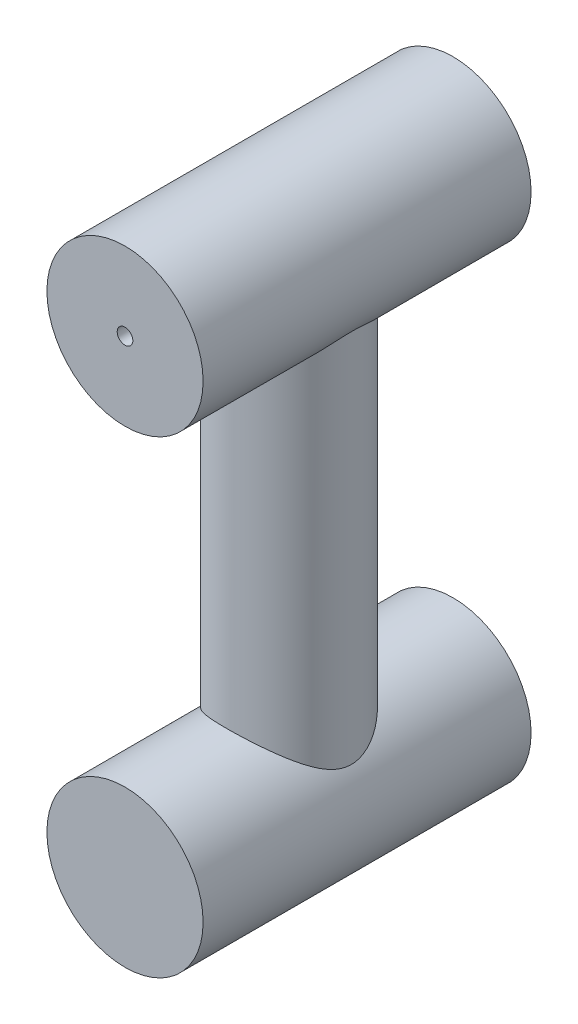
from build123d import *

# Parameters (mm, degrees)
SKETCH1_R           = 25
BOSS_EXTRUDE1_DEPTH = 52.5
SKETCH2_R           = 2.5
CUT_EXTRUDE1_DEPTH  = 10
SKETCH3_R           = 20
BOSS_EXTRUDE2_DEPTH = 150
CUT_EXTRUDE2_START  = -5
SKETCH4_R           = 2.5
CUT_EXTRUDE2_DEPTH  = 5


with BuildPart() as part:
    # Sketch1 → Boss-Extrude1 (new, symmetric)
    with BuildSketch(Plane.XY):
        Circle(SKETCH1_R)
    boss_extrude1 = extrude(amount=BOSS_EXTRUDE1_DEPTH, both=True)

    # Sketch2 → Cut-Extrude1 (cut)
    with BuildSketch(Plane(origin=(0, 0, -52.5), x_dir=(-1, 0, 0), z_dir=(0, 0, -1))):
        Circle(SKETCH2_R)
    cut_extrude1 = extrude(amount=-CUT_EXTRUDE1_DEPTH, mode=Mode.SUBTRACT)

    # Sketch3 → Boss-Extrude2 (add)
    with BuildSketch(Plane(origin=(0, 0, 0), x_dir=(1, 0, 0), z_dir=(0, 1, 0))):
        with Locations(Location((0, 0, 0), (0, 0, 90))):
            Circle(SKETCH3_R)
    extrude(amount=BOSS_EXTRUDE2_DEPTH)

    # Mirror1: Boss-Extrude1, Cut-Extrude1 across plane
    add(boss_extrude1.mirror(Plane.ZX.offset(75)))
    add(cut_extrude1.mirror(Plane.ZX.offset(75)), mode=Mode.SUBTRACT)

    # Sketch4 → Cut-Extrude2 (cut)
    with BuildSketch(Plane.XY.offset(52.5).offset(CUT_EXTRUDE2_START)):
        with Locations(Location((0, 150, 0), (0, 0, 180))):
            Circle(SKETCH4_R)
    extrude(amount=CUT_EXTRUDE2_DEPTH, mode=Mode.SUBTRACT)


solid = part.part
